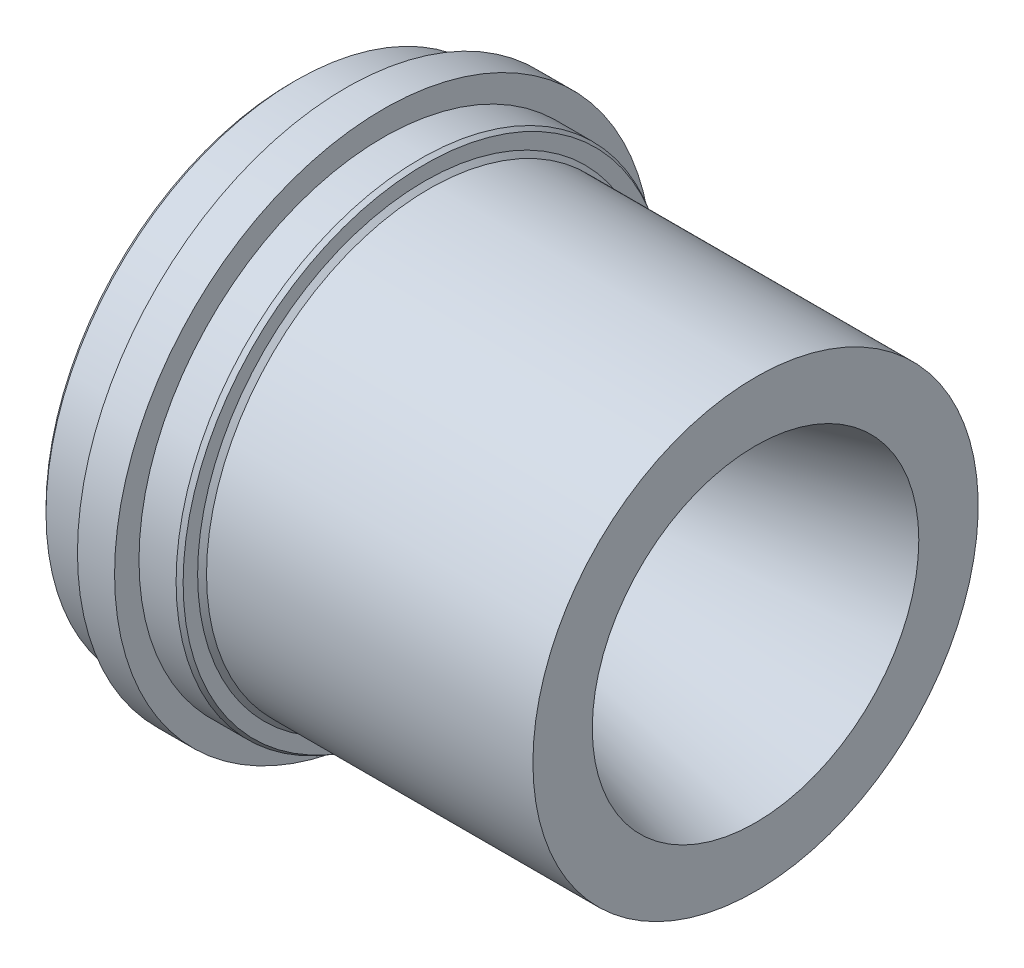
from build123d import *

# Parameters (mm, degrees)
CUT_EXTRUDE1_DEPTH      = 124.385507346
CUT_EXTRUDE1_DEPTH_BACK = 124.385507346
SKETCH2_W               = 25.452213303
SKETCH2_H               = 76.2


with BuildPart() as part:
    # Sketch1 → Revolve1 (revolve)
    with BuildSketch(Plane.XY, mode=Mode.PRIVATE) as revolve1_sk:
        with BuildLine():
            Line((0, 36.4109), (0, 41.9989))
            Line((0, 41.9989), (0.762, 42.7609))
            Line((0.762, 42.7609), (9.3472, 42.7609))
            Line((9.3472, 42.7609), (9.3472, 45.9613))
            Line((9.3472, 45.9613), (15.6972, 45.9613))
            Line((15.6972, 45.9613), (15.6972, 41.783))
            Line((15.6972, 41.783), (22.0472, 41.783))
            Line((22.0472, 41.783), (22.8092, 41.343059095))
            Line((22.8092, 41.343059095), (22.8092, 38.862))
            Line((22.8092, 38.862), (23.5712, 38.1))
            Line((23.5712, 38.1), (104.1146, 38.1))
            Line((104.1146, 38.1), (104.8766, 37.338))
            Line((104.8766, 37.338), (104.8766, 34.7599))
            Line((104.8766, 34.7599), (22.6314, 12.722365079))
            ThreePointArc((22.6314, 12.722365079), (15.406658957, 13.955510804), (10.066398525, 18.975386305))
            Line((10.066398525, 18.975386305), (0, 36.4109))
        make_face()
    revolve(revolve1_sk.sketch.rotate(Axis((0, 0, 0), (1, 0, 0)), 90), axis=Axis((0, 0, 0), (1, 0, 0)))

    # Sketch2 → Cut-Extrude1 (cut, two sides: drawn at the far end of the back side and taken through both)
    with BuildSketch(Plane.XY.offset(-CUT_EXTRUDE1_DEPTH_BACK)):
        with Locations((92.150493349, 0)):
            Rectangle(SKETCH2_W, SKETCH2_H)
    extrude(amount=CUT_EXTRUDE1_DEPTH + CUT_EXTRUDE1_DEPTH_BACK, mode=Mode.SUBTRACT)


solid = part.part
